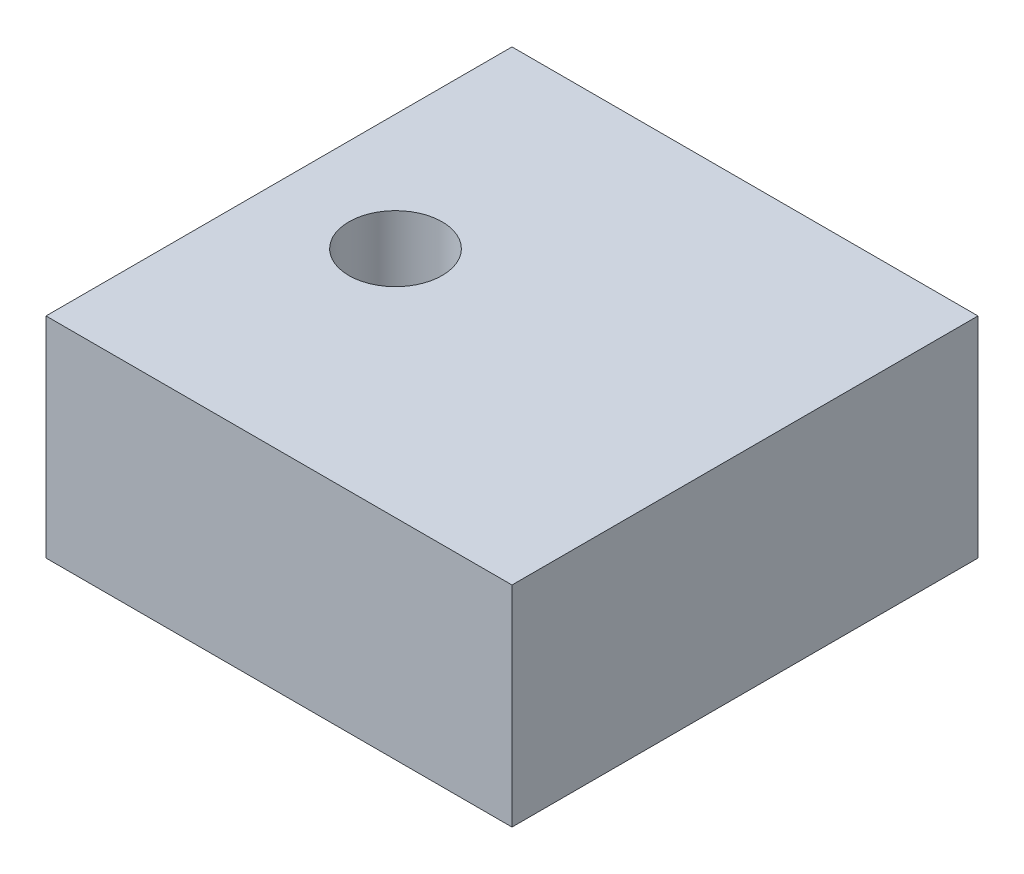
from build123d import *

# Parameters (mm, degrees)
SKETCH1_W           = 40
SKETCH1_H           = 40
SKETCH1_R           = 4
BOSS_EXTRUDE1_DEPTH = 18


with BuildPart() as part:
    # Sketch1 → Boss-Extrude1 (new body)
    with BuildSketch(Plane(origin=(0, 0, 0), x_dir=(1, 0, 0), z_dir=(0, 1, 0))):
        Rectangle(SKETCH1_W, SKETCH1_H)
        with Locations(Location((-10, 0, 0), (0, 0, 270))):
            Circle(SKETCH1_R, mode=Mode.SUBTRACT)
    extrude(amount=BOSS_EXTRUDE1_DEPTH)


solid = part.part
